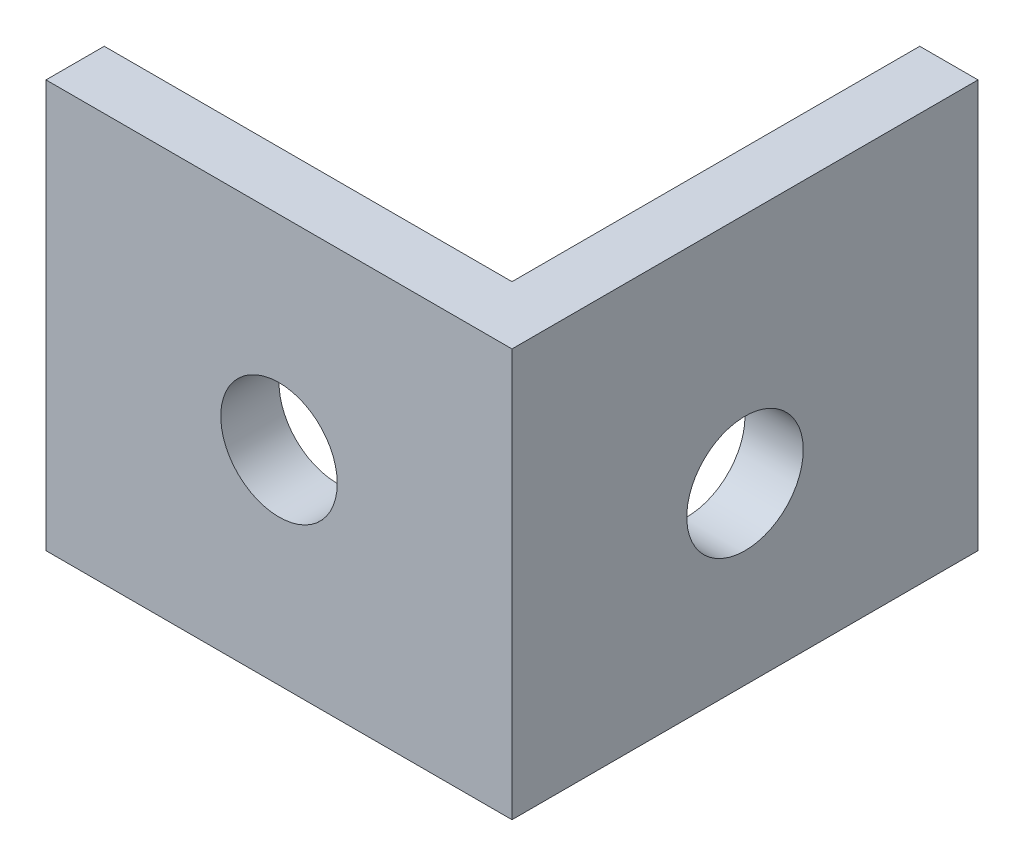
from build123d import *

# Parameters (mm, degrees)
BOSS_EXTRUDE1_DEPTH = 22.225
SKETCH2_R           = 3.175
CUT_EXTRUDE1_DEPTH  = 25.4
SKETCH3_R           = 3.175
CUT_EXTRUDE2_DEPTH  = 25.4


with BuildPart() as part:
    # Sketch1 → Boss-Extrude1 (new body)
    with BuildSketch(Plane(origin=(0, 0, 0), x_dir=(1, 0, 0), z_dir=(0, 1, 0))):
        Polygon((0, 0), (25.4, 0), (25.4, 25.4), (22.225, 25.4), (22.225, 3.175), (0, 3.175), align=None)
    extrude(amount=BOSS_EXTRUDE1_DEPTH)

    # Sketch2 → Cut-Extrude1 (cut)
    with BuildSketch(Plane(origin=(25.4, 0, 0), x_dir=(0, 0, -1), z_dir=(1, 0, 0))):
        with Locations((12.7, 9.525)):
            Circle(SKETCH2_R)
    extrude(amount=-CUT_EXTRUDE1_DEPTH, mode=Mode.SUBTRACT)

    # Sketch3 → Cut-Extrude2 (cut)
    with BuildSketch(Plane.XY):
        with Locations((12.7, 11.1125)):
            Circle(SKETCH3_R)
    extrude(amount=-CUT_EXTRUDE2_DEPTH, mode=Mode.SUBTRACT)


solid = part.part
